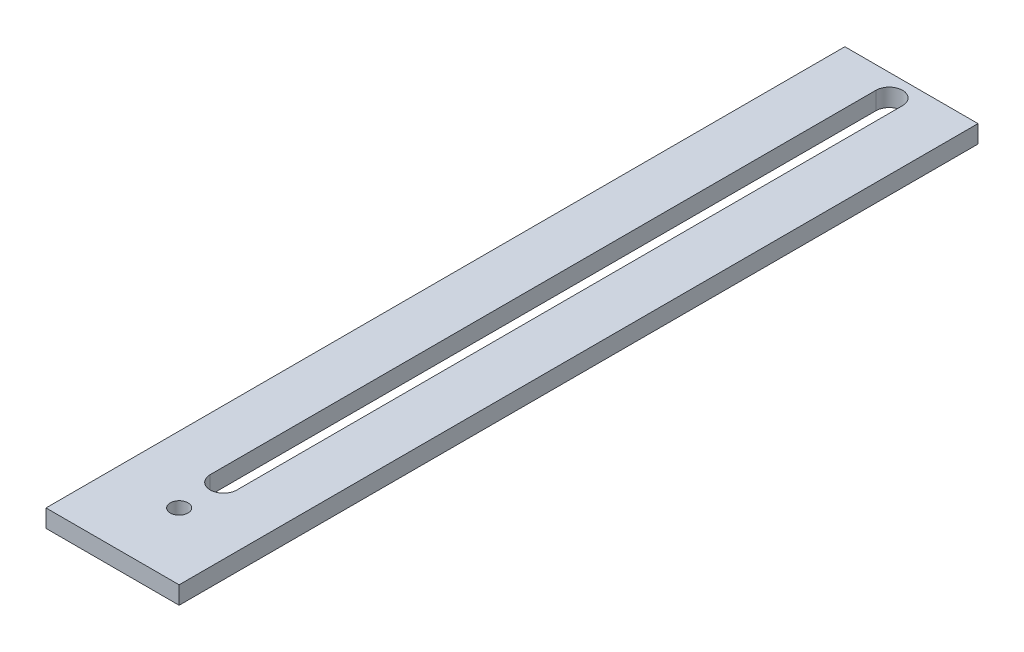
from build123d import *

# Parameters (mm, degrees)
SKETCH1_W           = 30
SKETCH1_H           = 30
SKETCH1_R           = 2
BOSS_EXTRUDE1_DEPTH = 4
SKETCH2_W           = 30
SKETCH2_H           = 4
BOSS_EXTRUDE2_DEPTH = 150
CUT_EXTRUDE1_DEPTH  = 166.728693955


with BuildPart() as part:
    # Sketch1 → Boss-Extrude1 (new body)
    with BuildSketch(Plane(origin=(0, 0, 0), x_dir=(1, 0, 0), z_dir=(0, 1, 0))):
        Rectangle(SKETCH1_W, SKETCH1_H)
        with Locations(Location((0, 0, 0), (0, 0, 270))):
            Circle(SKETCH1_R, mode=Mode.SUBTRACT)
    extrude(amount=BOSS_EXTRUDE1_DEPTH)

    # Sketch2 → Boss-Extrude2 (add)
    with BuildSketch(Plane(origin=(0, 0, -15), x_dir=(-1, 0, 0), z_dir=(0, 0, -1))):
        with Locations((0, 2)):
            Rectangle(SKETCH2_W, SKETCH2_H)
    extrude(amount=BOSS_EXTRUDE2_DEPTH)

    # Sketch3 → Cut-Extrude1 (cut, through all)
    with BuildSketch(Plane(origin=(0, 4, 0), x_dir=(1, 0, 0), z_dir=(0, 1, 0))):
        with BuildLine():
            Line((-3, 10), (-3, 160))
            ThreePointArc((-3, 160), (0, 163), (3, 160))
            Line((3, 160), (3, 10))
            ThreePointArc((3, 10), (0, 7), (-3, 10))
        make_face()
    extrude(amount=-CUT_EXTRUDE1_DEPTH, mode=Mode.SUBTRACT)


solid = part.part
